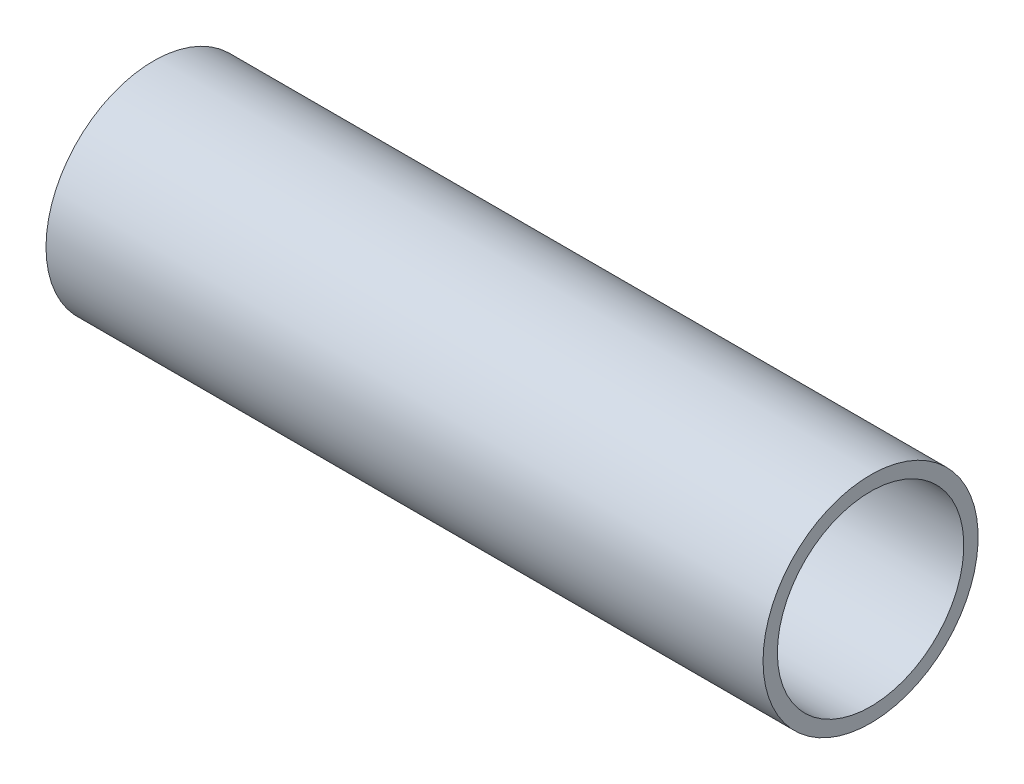
from build123d import *

# Parameters (mm, degrees)
ESQUISSE1_W = 100
ESQUISSE1_H = 2


with BuildPart() as part:
    # Esquisse1 → Révolution1 (revolve)
    with BuildSketch(Plane.XY, mode=Mode.PRIVATE) as r_volution1_sk:
        with Locations((50, 14)):
            Rectangle(ESQUISSE1_W, ESQUISSE1_H)
    revolve(r_volution1_sk.sketch.rotate(Axis((0, 0, 0), (1, 0, 0)), 90), axis=Axis((0, 0, 0), (1, 0, 0)))


solid = part.part
